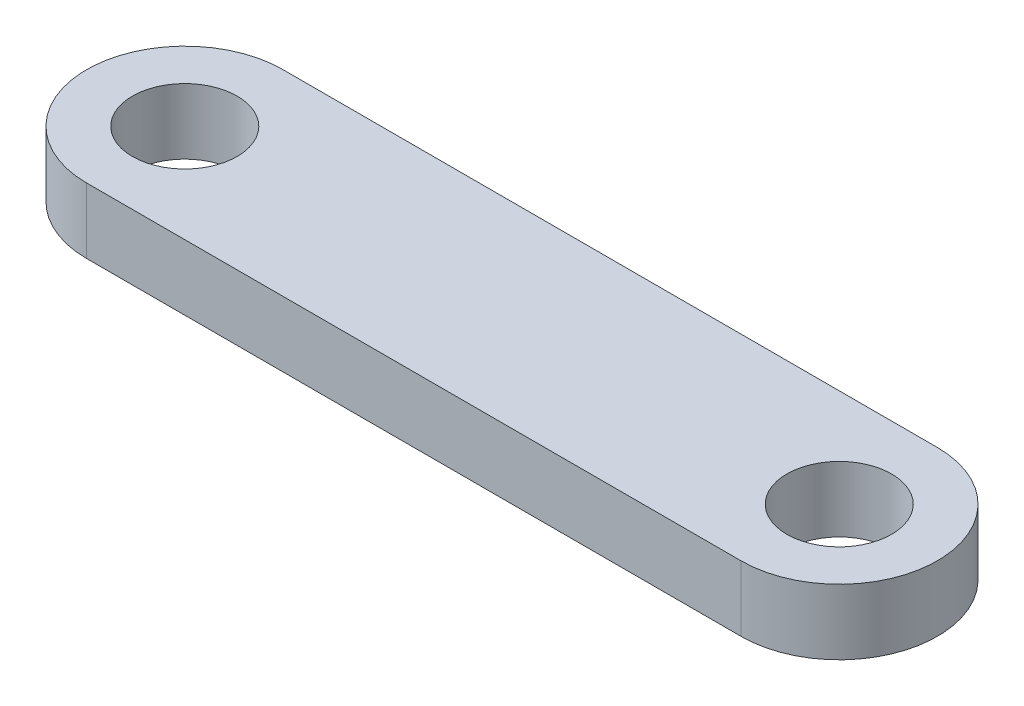
from build123d import *

# Parameters (mm, degrees)
SKETCH1_R           = 4
BOSS_EXTRUDE1_DEPTH = 2.5


with BuildPart() as part:
    # Sketch1 → Boss-Extrude1 (new, symmetric)
    with BuildSketch(Plane(origin=(0, 0, 0), x_dir=(1, 0, 0), z_dir=(0, 1, 0))):
        with BuildLine():
            Line((0, 7.5), (50, 7.5))
            ThreePointArc((50, 7.5), (57.5, 0), (50, -7.5))
            Line((50, -7.5), (0, -7.5))
            ThreePointArc((0, -7.5), (-7.5, 0), (0, 7.5))
        make_face()
        with Locations(Location((0, 0, 0), (0, 0, 270))):
            Circle(SKETCH1_R, mode=Mode.SUBTRACT)
        with Locations(Location((50, 0, 0), (0, 0, 270))):
            Circle(SKETCH1_R, mode=Mode.SUBTRACT)
    extrude(amount=BOSS_EXTRUDE1_DEPTH, both=True)


solid = part.part
